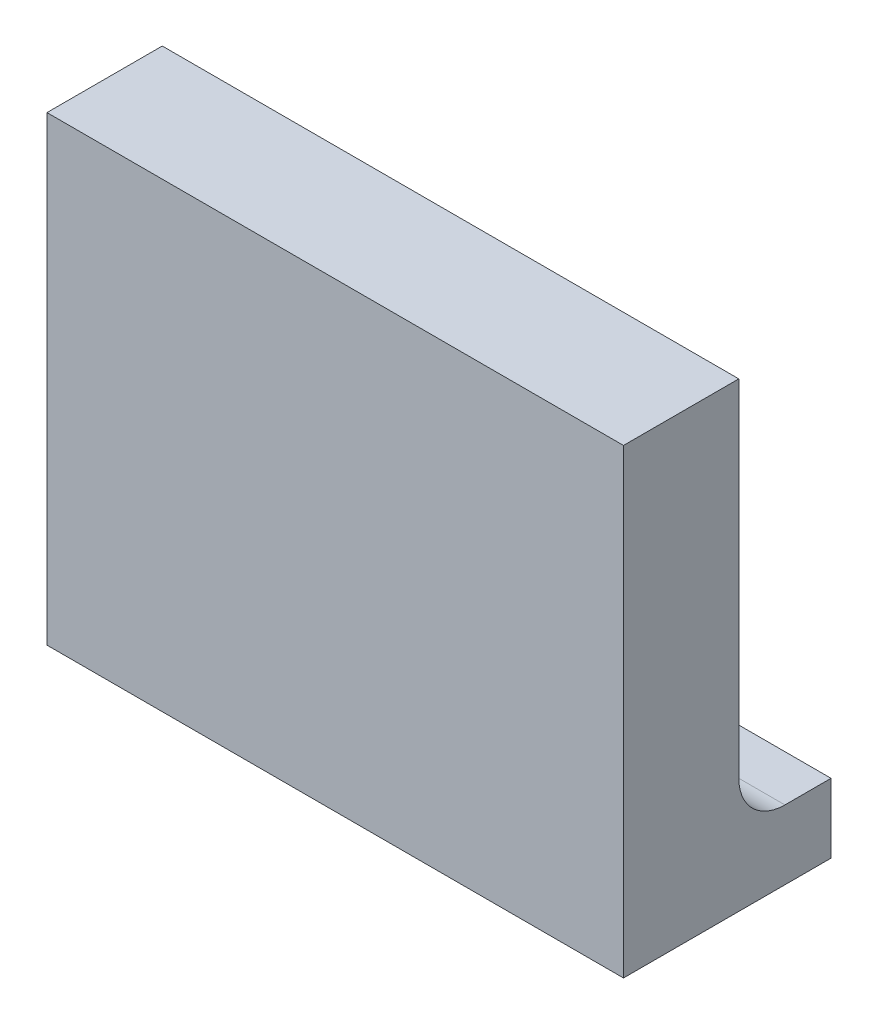
from build123d import *

# Parameters (mm, degrees)
BOSS_EXTRUDE1_DEPTH = 25
FILLET1_R           = 2


with BuildPart() as part:
    # Sketch2 → Boss-Extrude1 (new body)
    with BuildSketch(Plane(origin=(0, 0, 0), x_dir=(0, 0, -1), z_dir=(1, 0, 0))):
        Polygon((0, 0), (-9, 0), (-9, 20), (-4, 20), (-4, 3), (0, 3), align=None)
    extrude(amount=BOSS_EXTRUDE1_DEPTH)

    # Fillet1
    fillet1_edges = [part.edges().sort_by_distance(p)[0] for p in [
        (12.5, 3, 4),
    ]]
    fillet(fillet1_edges, radius=FILLET1_R)


solid = part.part
